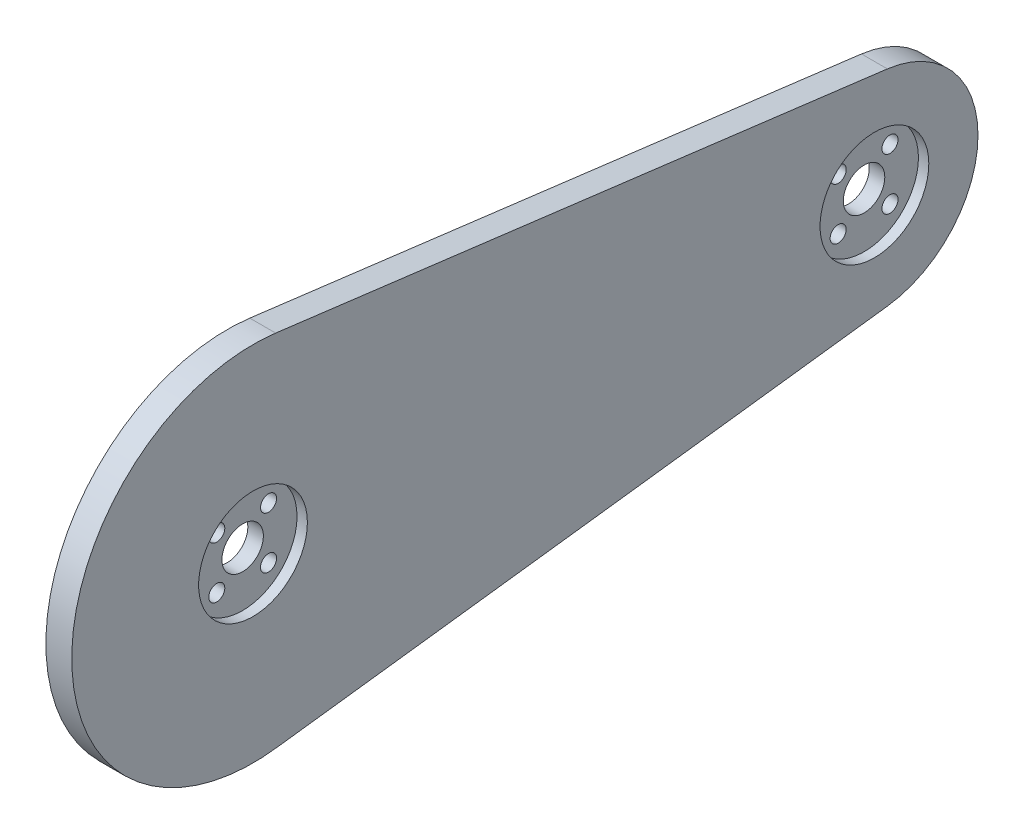
from build123d import *

# Parameters (mm, degrees)
SKETCH_1_R          = 1.55
SKETCH_1_R_2        = 4
EXTRUDE_3_DEPTH     = 5
SKETCH_3_R          = 10.5
CUT_EXTRUDE_2_DEPTH = 2


with BuildPart() as part:
    # 草图1 → 凸台-拉伸3 (new body)
    with BuildSketch(Plane(origin=(0, 0, 0), x_dir=(0, 0, -1), z_dir=(1, 0, 0))):
        with BuildLine():
            Line((122.5, 19.843134833), (4.375, 34.725485958))
            ThreePointArc((4.375, 34.725485958), (-34.998579399, -0.315341144), (5, -34.641016151))
            Line((5, -34.641016151), (122.499047902, -19.843254763))
            ThreePointArc((122.499047902, -19.843254763), (139.999999994, -0.000479811), (122.5, 19.843134833))
        make_face()
        with Locations((-5, -5)):
            Circle(SKETCH_1_R, mode=Mode.SUBTRACT)
        with Locations((5, -5)):
            Circle(SKETCH_1_R, mode=Mode.SUBTRACT)
        with Locations((-5, 5)):
            Circle(SKETCH_1_R, mode=Mode.SUBTRACT)
        Circle(SKETCH_1_R_2, mode=Mode.SUBTRACT)
        with Locations((5, 5)):
            Circle(SKETCH_1_R, mode=Mode.SUBTRACT)
        with Locations((115, -5)):
            Circle(SKETCH_1_R, mode=Mode.SUBTRACT)
        with Locations((125, -5)):
            Circle(SKETCH_1_R, mode=Mode.SUBTRACT)
        with Locations((125, 5)):
            Circle(SKETCH_1_R, mode=Mode.SUBTRACT)
        with Locations((115, 5)):
            Circle(SKETCH_1_R, mode=Mode.SUBTRACT)
        with Locations((120, 0)):
            Circle(SKETCH_1_R_2, mode=Mode.SUBTRACT)
    extrude(amount=EXTRUDE_3_DEPTH)

    # 草图3 → 切除-拉伸2 (cut)
    with BuildSketch(Plane(origin=(5, 0, 0), x_dir=(0, 0, -1), z_dir=(1, 0, 0))):
        Circle(SKETCH_3_R)
        with Locations((120, 0)):
            Circle(SKETCH_3_R)
    extrude(amount=-CUT_EXTRUDE_2_DEPTH, mode=Mode.SUBTRACT)


solid = part.part
